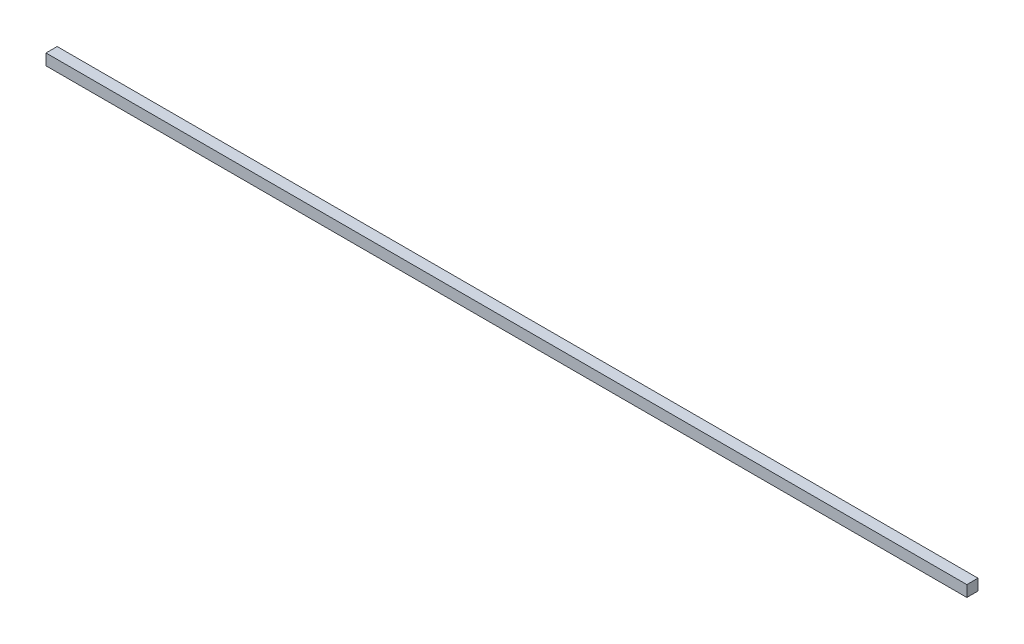
from build123d import *

# Parameters (mm, degrees)
TOPPING_KLAPE_KAT3_PIVOT_MIL_1_START = 22
SKETCH1_W                            = 660
SKETCH1_H                            = 8
TOPPING_KLAPE_KAT3_PIVOT_MIL_1_DEPTH = 8


with BuildPart() as part:
    # Sketch1 → TOPPING_klape_kat3_pivot_mil_1 (new body)
    with BuildSketch(Plane.XY.offset(TOPPING_KLAPE_KAT3_PIVOT_MIL_1_START)):
        with Locations((350, 746)):
            Rectangle(SKETCH1_W, SKETCH1_H)
    extrude(amount=TOPPING_KLAPE_KAT3_PIVOT_MIL_1_DEPTH)


solid = part.part
